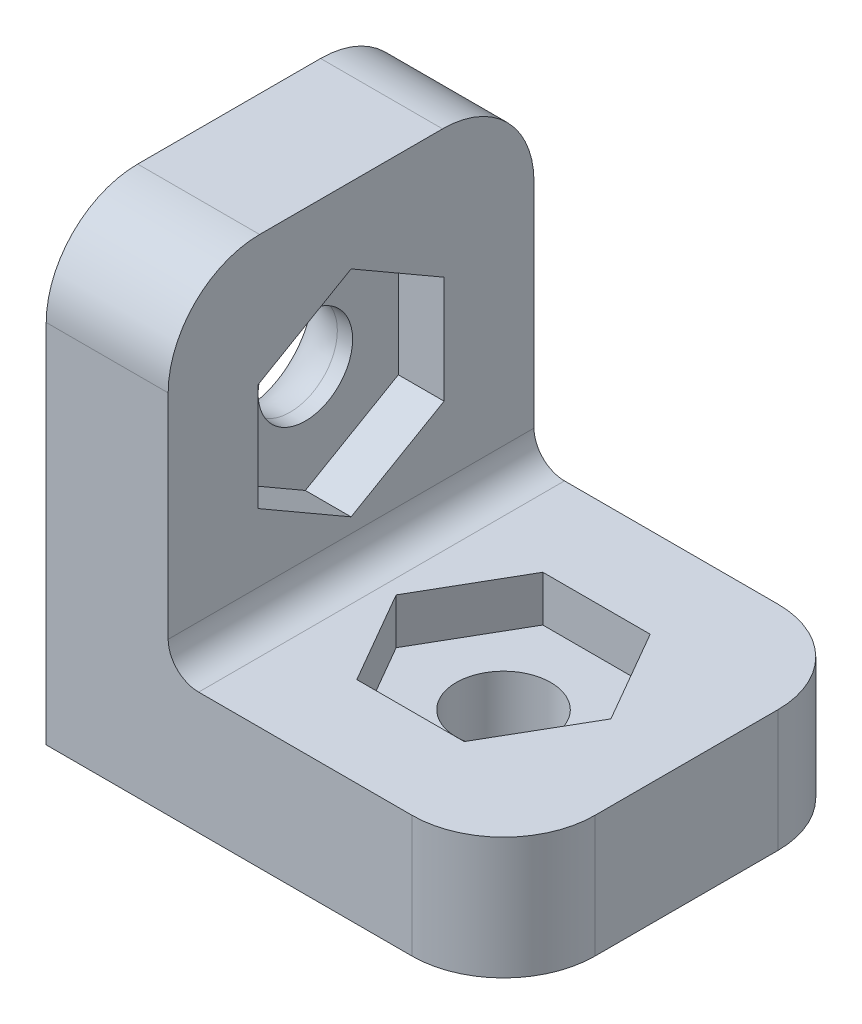
from build123d import *

# Parameters (mm, degrees)
BOSS_EXTRUDE1_DEPTH = 12
SKETCH2_R           = 1.55
CUT_EXTRUDE1_DEPTH  = 23.135943621
CUT_EXTRUDE2_DEPTH  = 1.5
SKETCH4_R           = 1.55
CUT_EXTRUDE3_DEPTH  = 23.135943621
CUT_EXTRUDE4_DEPTH  = 1.5
FILLET1_R           = 2
FILLET2_R           = 1
FILLET3_R           = 3


with BuildPart() as part:
    # Sketch1 → Boss-Extrude1 (new body)
    with BuildSketch(Plane.XY):
        Polygon((0, 0), (0, 15), (4, 15), (4, 4), (15, 4), (15, 0), align=None)
    extrude(amount=BOSS_EXTRUDE1_DEPTH)

    # Sketch2 → Cut-Extrude1 (cut, through all)
    with BuildSketch(Plane(origin=(0, 4, 0), x_dir=(1, 0, 0), z_dir=(0, 1, 0))):
        with Locations(Location((9, -6, 0), (0, 0, 270))):
            Circle(SKETCH2_R)
    extrude(amount=-CUT_EXTRUDE1_DEPTH, mode=Mode.SUBTRACT)

    # Sketch3 → Cut-Extrude2 (cut)
    with BuildSketch(Plane(origin=(0, 4, 0), x_dir=(1, 0, 0), z_dir=(0, 1, 0))):
        Polygon((5.478163358, -6), (7.239081679, -9.05), (10.760918321, -9.05), (12.521836642, -6), (10.760918321, -2.95), (7.239081679, -2.95), align=None)
    extrude(amount=-CUT_EXTRUDE2_DEPTH, mode=Mode.SUBTRACT)

    # Sketch4 → Cut-Extrude3 (cut, through all)
    with BuildSketch(Plane(origin=(4, 0, 0), x_dir=(0, 0, -1), z_dir=(1, 0, 0))):
        with Locations(Location((-6, 9, 0), (0, 0, 90))):
            Circle(SKETCH4_R)
    extrude(amount=-CUT_EXTRUDE3_DEPTH, mode=Mode.SUBTRACT)

    # Sketch5 → Cut-Extrude4 (cut)
    with BuildSketch(Plane(origin=(4, 0, 0), x_dir=(0, 0, -1), z_dir=(1, 0, 0))):
        Polygon((-6, 5.478163358), (-2.95, 7.239081679), (-2.95, 10.760918321), (-6, 12.521836642), (-9.05, 10.760918321), (-9.05, 7.239081679), align=None)
    extrude(amount=-CUT_EXTRUDE4_DEPTH, mode=Mode.SUBTRACT)

    # Fillet1
    fillet1_edges = [part.edges().sort_by_distance(p)[0] for p in [
        (0, 7.45, 6),
    ]]
    fillet(fillet1_edges, radius=FILLET1_R)

    # Fillet2
    fillet2_edges = [part.edges().sort_by_distance(p)[0] for p in [
        (4, 4, 6),
    ]]
    fillet(fillet2_edges, radius=FILLET2_R)

    # Fillet3
    fillet3_edges = [part.edges().sort_by_distance(p)[0] for p in [
        (2, 15, 12),
        (2, 15, 0),
        (15, 2, 12),
        (15, 2, 0),
    ]]
    fillet(fillet3_edges, radius=FILLET3_R)


solid = part.part
